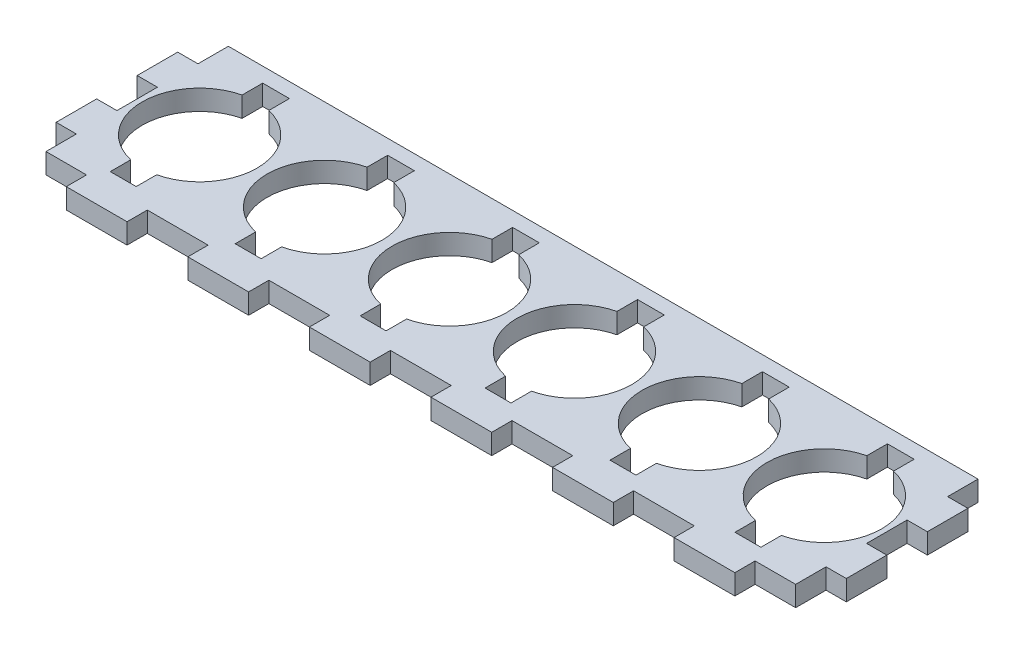
from build123d import *

# Parameters (mm, degrees)
ESQUISSE1_W                     = 234.95
ESQUISSE1_H                     = 57.15
BOSS_EXTRU_1_DEPTH              = 6.35
ENL_V_MAT_EXTRU_1_DEPTH         = 6.35
R_P_TITION_LIN_AIRE1_COUNT      = 6
R_P_TITION_LIN_AIRE1_PITCH      = 39.158333333
ESQUISSE3_W                     = 19.05
ESQUISSE3_H                     = 6.35
BOSS_EXTRU_2_DEPTH              = 6.35
R_P_TITION_LIN_AIRE2_COUNT      = 6
R_P_TITION_LIN_AIRE2_PITCH      = 38.1
ESQUISSE5_W                     = 6.35
ESQUISSE5_H                     = 12.7
BOSS_EXTRU_4_DEPTH              = 6.35
R_P_TITION_LIN_AIRE4_COUNT      = 2
R_P_TITION_LIN_AIRE4_PITCH      = 25.4
R_P_TITION_LIN_AIRE4_COUNT_DIR2 = 2
R_P_TITION_LIN_AIRE4_PITCH_DIR2 = 241.3


with BuildPart() as part:
    # Esquisse1 → Boss.-Extru.1 (new body)
    with BuildSketch(Plane(origin=(0, 0, 0), x_dir=(1, 0, 0), z_dir=(0, 1, 0))):
        Rectangle(ESQUISSE1_W, ESQUISSE1_H)
    extrude(amount=BOSS_EXTRU_1_DEPTH)

    # Esquisse2 → Enlèv. mat.-Extru.1 (cut)
    with BuildSketch(Plane(origin=(0, 6.35, 0), x_dir=(1, 0, 0), z_dir=(0, 1, 0))):
        with BuildLine():
            Line((93.704833333, 17.50529974), (93.704833333, 23.953124941))
            Line((93.704833333, 23.953124941), (102.086833333, 23.953124941))
            Line((102.086833333, 23.953124941), (102.086833333, 17.50529974))
            ThreePointArc((102.086833333, 17.50529974), (115.89571511, -0.065238332), (101.959833333, -17.535218961))
            Line((101.959833333, -17.535218961), (101.959833333, -23.953124941))
            Line((101.959833333, -23.953124941), (93.831833333, -23.953124941))
            Line((93.831833333, -23.953124941), (93.831833333, -17.535218961))
            ThreePointArc((93.831833333, -17.535218961), (79.895951557, -0.065238332), (93.704833333, 17.50529974))
        make_face()
    enl_v_mat_extru_1 = extrude(amount=-ENL_V_MAT_EXTRU_1_DEPTH, mode=Mode.SUBTRACT)

    # Répétition linéaire1: Enlèv. mat.-Extru.1 ×6
    with Locations(*[(-i * R_P_TITION_LIN_AIRE1_PITCH, 0, 0) for i in range(1, R_P_TITION_LIN_AIRE1_COUNT)]):
        add(enl_v_mat_extru_1, mode=Mode.SUBTRACT)

    # Esquisse3 → Boss.-Extru.2 (add)
    with BuildSketch(Plane(origin=(0, 6.35, 0), x_dir=(1, 0, 0), z_dir=(0, 1, 0))):
        with Locations((-95.25, -31.75)):
            Rectangle(ESQUISSE3_W, ESQUISSE3_H)
    boss_extru_2 = extrude(amount=-BOSS_EXTRU_2_DEPTH)

    # Répétition linéaire2: Boss.-Extru.2 ×6
    with Locations(*[(i * R_P_TITION_LIN_AIRE2_PITCH, 0, 0) for i in range(1, R_P_TITION_LIN_AIRE2_COUNT)]):
        add(boss_extru_2)

    # Esquisse5 → Boss.-Extru.4 (add)
    with BuildSketch(Plane(origin=(0, 6.35, 0), x_dir=(1, 0, 0), z_dir=(0, 1, 0))):
        with Locations((-120.65, -12.7)):
            Rectangle(ESQUISSE5_W, ESQUISSE5_H)
    boss_extru_4 = extrude(amount=-BOSS_EXTRU_4_DEPTH)

    # Répétition linéaire4: Boss.-Extru.4 2 × 2
    with Locations(*[(j * R_P_TITION_LIN_AIRE4_PITCH_DIR2, 0, -i * R_P_TITION_LIN_AIRE4_PITCH) for i in range(R_P_TITION_LIN_AIRE4_COUNT) for j in range(R_P_TITION_LIN_AIRE4_COUNT_DIR2) if (i, j) != (0, 0)]):
        add(boss_extru_4)


solid = part.part
